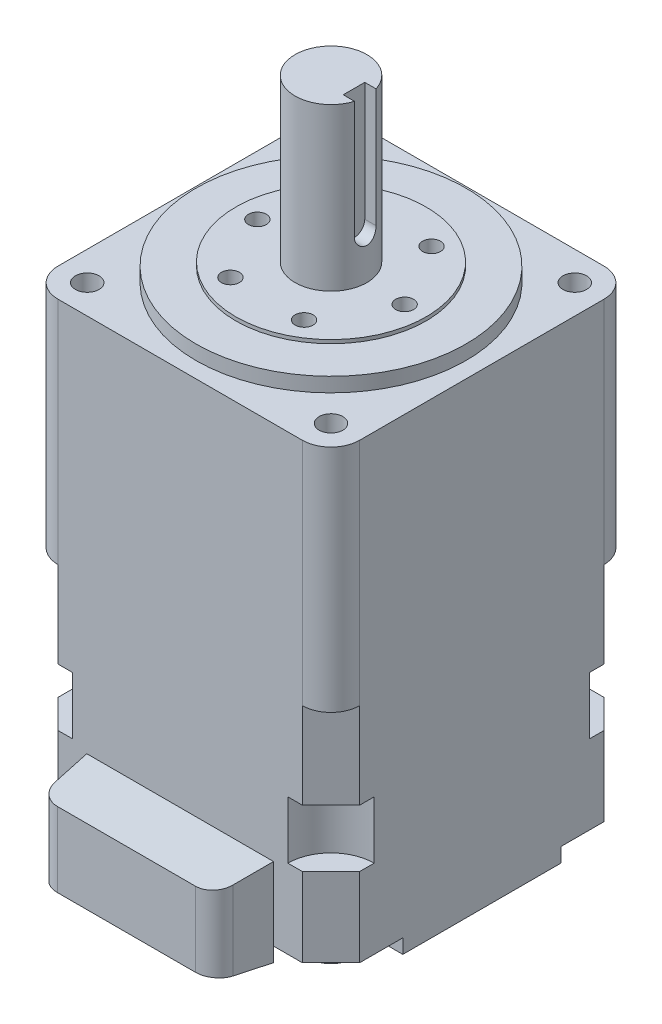
from build123d import *

# Parameters (mm, degrees)
EXTRUDE_1_DEPTH          = 65
CUT_EXTRUDE_1_DEPTH      = 33
CUT_EXTRUDE_START        = -13
CUT_EXTRUDE_2_DEPTH      = 8
CUT_EXTRUDE_3_DEPTH      = 2
SKETCH_5_R               = 3
EXTRUDE_2_DEPTH          = 1.5
SKETCH_6_W               = 26
SKETCH_6_H               = 12.2
EXTRUDE_3_DEPTH          = 7.5
CUT_EXTRUDE_4_REACH      = 80.697
CUT_EXTRUDE_5_REACH      = 76.015
FILLET_2_R               = 2.8
SKETCH_10_R              = 18.8
EXTRUDE_4_DEPTH          = 2
SKETCH_11_R              = 13.25
EXTRUDE_5_DEPTH          = 0.5
SKETCH_12_R              = 5
EXTRUDE_6_DEPTH          = 22.5
CUT_EXTRUDE_6_REACH      = 101.912
CUT_EXTRUDE_6_END_RADIUS = 5
CUT_EXTRUDE_START_2      = 3.2
HOLE_WIZARD_M3_2_D       = 2.5
HOLE_WIZARD_M3_2_DEPTH   = 6.5
HOLE_WIZARD_M3_2_TIP     = 0.751075774
HOLE_WIZARD_M4_1_D       = 3.3
HOLE_WIZARD_M4_1_DEPTH   = 10
HOLE_WIZARD_M4_1_TIP     = 0.991420021


with BuildPart() as part:
    # 草图1 → 凸台-拉伸1 (new body)
    with BuildSketch(Plane(origin=(0, 0, 0), x_dir=(1, 0, 0), z_dir=(0, 1, 0))):
        with BuildLine():
            Line((17, -21), (-17, -21))
            ThreePointArc((-17, -21), (-19.828427125, -19.828427125), (-21, -17))
            Line((-21, -17), (-21, 17))
            ThreePointArc((-21, 17), (-19.828427125, 19.828427125), (-17, 21))
            Line((-17, 21), (17, 21))
            ThreePointArc((17, 21), (19.828427125, 19.828427125), (21, 17))
            Line((21, 17), (21, -17))
            ThreePointArc((21, -17), (19.828427125, -19.828427125), (17, -21))
        make_face()
    extrude(amount=EXTRUDE_1_DEPTH)

    # 草图2 → 切除-拉伸1 (cut)
    with BuildSketch(Plane.XZ):
        with BuildLine():
            Line((-17, 21), (-21, 17))
            ThreePointArc((-21, 17), (-19.828427125, 19.828427125), (-17, 21))
        make_face()
        with BuildLine():
            Line((17, 21), (21, 17))
            ThreePointArc((21, 17), (19.828427125, 19.828427125), (17, 21))
        make_face()
        with BuildLine():
            Line((-21, -17), (-17, -21))
            ThreePointArc((-17, -21), (-19.828427125, -19.828427125), (-21, -17))
        make_face()
        with BuildLine():
            Line((21, -17), (17, -21))
            ThreePointArc((17, -21), (19.828427125, -19.828427125), (21, -17))
        make_face()
    extrude(amount=-CUT_EXTRUDE_1_DEPTH, mode=Mode.SUBTRACT)

    # 草图3 → 切除-拉伸2 (cut)
    with BuildSketch(Plane.XZ.offset(CUT_EXTRUDE_START)):
        with BuildLine():
            Line((-21, 15), (-21, 21))
            Line((-21, 21), (-15, 21))
            ThreePointArc((-15, 21), (-16.757359313, 16.757359313), (-21, 15))
        make_face()
        with BuildLine():
            Line((21, 21), (15, 21))
            ThreePointArc((15, 21), (16.757359313, 16.757359313), (21, 15))
            Line((21, 15), (21, 21))
        make_face()
        with BuildLine():
            Line((-21, -21), (-15, -21))
            ThreePointArc((-15, -21), (-16.757359313, -16.757359313), (-21, -15))
            Line((-21, -15), (-21, -21))
        make_face()
        with BuildLine():
            Line((21, -15), (21, -21))
            Line((21, -21), (15, -21))
            ThreePointArc((15, -21), (16.757359313, -16.757359313), (21, -15))
        make_face()
    extrude(amount=-CUT_EXTRUDE_2_DEPTH, mode=Mode.SUBTRACT)

    # 草图4 → 切除-拉伸3 (cut)
    with BuildSketch(Plane.XZ):
        with BuildLine():
            Line((-21, 21), (-11, 21))
            Line((-11, 21), (-11, 16))
            ThreePointArc((-11, 16), (-12.464466094, 12.464466094), (-16, 11))
            Line((-16, 11), (-21, 11))
            Line((-21, 11), (-21, 21))
        make_face()
        with BuildLine():
            Line((11, 21), (11, 16))
            ThreePointArc((11, 16), (12.464466094, 12.464466094), (16, 11))
            Line((16, 11), (21, 11))
            Line((21, 11), (21, 21))
            Line((21, 21), (11, 21))
        make_face()
        with BuildLine():
            Line((-11, -21), (-11, -16))
            ThreePointArc((-11, -16), (-12.464466094, -12.464466094), (-16, -11))
            Line((-16, -11), (-21, -11))
            Line((-21, -11), (-21, -21))
            Line((-21, -21), (-11, -21))
        make_face()
        with BuildLine():
            Line((21, -21), (11, -21))
            Line((11, -21), (11, -16))
            ThreePointArc((11, -16), (12.464466094, -12.464466094), (16, -11))
            Line((16, -11), (21, -11))
            Line((21, -11), (21, -21))
        make_face()
    extrude(amount=-CUT_EXTRUDE_3_DEPTH, mode=Mode.SUBTRACT)

    # 草图5 → 凸台-拉伸2 (add)
    with BuildSketch(Plane.XZ.offset(-2)):
        with Locations(Location((-15.5, 15.5, 0), (0, 0, 270))):
            Circle(SKETCH_5_R)
        with Locations(Location((15.5, 15.5, 0), (0, 0, 90))):
            Circle(SKETCH_5_R)
        with Locations(Location((15.5, -15.5, 0), (0, 0, 270))):
            Circle(SKETCH_5_R)
        with Locations(Location((-15.5, -15.5, 0), (0, 0, 90))):
            Circle(SKETCH_5_R)
    extrude(amount=EXTRUDE_2_DEPTH)

    # 草图6 → 凸台-拉伸3 (add)
    with BuildSketch(Plane.XY.offset(21)):
        with Locations((0, 6.1)):
            Rectangle(SKETCH_6_W, SKETCH_6_H)
    extrude(amount=EXTRUDE_3_DEPTH)

    # 草图7 → 切除-拉伸4 (cut, up to next)
    with BuildSketch(Plane.ZY.offset(13), mode=Mode.PRIVATE) as cut_extrude_4_sk1:
        Polygon((21, 12.2), (28.5, 11.292400274), (28.5, 12.2), align=None)
    cut_extrude_4_tool1 = extrude(cut_extrude_4_sk1.sketch, amount=-CUT_EXTRUDE_4_REACH, mode=Mode.PRIVATE) & part.part
    # 草图7 → 切除-拉伸4 (cut, up to next)
    with BuildSketch(Plane.ZY.offset(13), mode=Mode.PRIVATE) as cut_extrude_4_sk2:
        Polygon((28.5, 0), (28.5, 0.907599726), (21, 0), align=None)
    cut_extrude_4_tool2 = extrude(cut_extrude_4_sk2.sketch, amount=-CUT_EXTRUDE_4_REACH, mode=Mode.PRIVATE) & part.part
    add(cut_extrude_4_tool1.solids().sort_by_distance((-13, 11.897467, 26))[0], mode=Mode.SUBTRACT)
    add(cut_extrude_4_tool2.solids().sort_by_distance((-13, 0.302533, 26))[0], mode=Mode.SUBTRACT)

    # 草图9 → 切除-拉伸5 (cut, up to next)
    with BuildSketch(Plane.XZ, mode=Mode.PRIVATE) as cut_extrude_5_sk1:
        Polygon((-13, 21), (-12.092400274, 28.5), (-13, 28.5), align=None)
    cut_extrude_5_tool1 = extrude(cut_extrude_5_sk1.sketch, amount=-CUT_EXTRUDE_5_REACH, mode=Mode.PRIVATE) & part.part
    # 草图9 → 切除-拉伸5 (cut, up to next)
    with BuildSketch(Plane.XZ, mode=Mode.PRIVATE) as cut_extrude_5_sk2:
        Polygon((13, 28.5), (13, 21), (12.092400274, 28.5), align=None)
    cut_extrude_5_tool2 = extrude(cut_extrude_5_sk2.sketch, amount=-CUT_EXTRUDE_5_REACH, mode=Mode.PRIVATE) & part.part
    add(cut_extrude_5_tool1.solids().sort_by_distance((-12.697467, 0, 26))[0], mode=Mode.SUBTRACT)
    add(cut_extrude_5_tool2.solids().sort_by_distance((12.697467, 0, 26))[0], mode=Mode.SUBTRACT)

    # 圆角2
    fillet_2_edges = [part.edges().sort_by_distance(p)[0] for p in [
        (-12.092400274, 6.1, 28.5),
        (12.092400274, 6.1, 28.5),
    ]]
    fillet(fillet_2_edges, radius=FILLET_2_R)

    # 草图10 → 凸台-拉伸4 (add)
    with BuildSketch(Plane(origin=(0, 65, 0), x_dir=(1, 0, 0), z_dir=(0, 1, 0))):
        with Locations(Location((0, 0, 0), (0, 0, 270))):
            Circle(SKETCH_10_R)
    extrude(amount=EXTRUDE_4_DEPTH)

    # 草图11 → 凸台-拉伸5 (add)
    with BuildSketch(Plane(origin=(0, 67, 0), x_dir=(1, 0, 0), z_dir=(0, 1, 0))):
        with Locations(Location((0, 0, 0), (0, 0, 270))):
            Circle(SKETCH_11_R)
    extrude(amount=EXTRUDE_5_DEPTH)

    # 草图12 → 凸台-拉伸6 (add)
    with BuildSketch(Plane(origin=(0, 67.5, 0), x_dir=(1, 0, 0), z_dir=(0, 1, 0))):
        with Locations(Location((0, 0, 0), (0, 0, 90))):
            Circle(SKETCH_12_R)
    extrude(amount=EXTRUDE_6_DEPTH)

    # 切除-拉伸6: up to this cylinder (the profile starts inside it)
    cut_extrude_6_end = Plane(origin=(0, 81.75, 0), z_dir=(0, -1, 0)) * Cylinder(CUT_EXTRUDE_6_END_RADIUS, 214.824, mode=Mode.PRIVATE)
    # 草图13 → 切除-拉伸6 (cut, up to the surface)
    with BuildSketch(Plane(origin=(0, 0, 0), x_dir=(0, 0, -1), z_dir=(1, 0, 0)).offset(CUT_EXTRUDE_START_2), mode=Mode.PRIVATE) as cut_extrude_6_sk1:
        with BuildLine():
            Line((1.5, 90), (1.5, 73.5))
            ThreePointArc((1.5, 73.5), (0, 72), (-1.5, 73.5))
            Line((-1.5, 73.5), (-1.5, 90))
            ThreePointArc((-1.5, 90), (0, 91.5), (1.5, 90))
        make_face()
    cut_extrude_6_tool1 = extrude(cut_extrude_6_sk1.sketch, amount=CUT_EXTRUDE_6_REACH, mode=Mode.PRIVATE) & cut_extrude_6_end
    add(cut_extrude_6_tool1.solids().sort_by_distance((3.2, 81.75, 0))[0], mode=Mode.SUBTRACT)

    # M3 螺纹孔2
    with Locations(Plane(origin=(0, 67.5, 0), x_dir=(1, 0, 0), z_dir=(0, 1, 0))):
        with Locations((5.125, 8.876760389), (10.25, 0), (5.125, -8.876760389), (-5.125, -8.876760389), (-10.25, 0), (-5.125, 8.876760389)):
            Hole(HOLE_WIZARD_M3_2_D / 2, depth=HOLE_WIZARD_M3_2_DEPTH)
            with Locations((0, 0, -(HOLE_WIZARD_M3_2_DEPTH + HOLE_WIZARD_M3_2_TIP / 2))):  # 118° drill point
                Cone(0, HOLE_WIZARD_M3_2_D / 2, HOLE_WIZARD_M3_2_TIP, mode=Mode.SUBTRACT)

    # M4 螺纹孔1
    with Locations(Plane(origin=(0, 65, 0), x_dir=(1, 0, 0), z_dir=(0, 1, 0))):
        with Locations((-16.970562748, -16.970562748), (-16.970562748, 16.970562748), (16.970562748, -16.970562748), (16.970562748, 16.970562748)):
            Hole(HOLE_WIZARD_M4_1_D / 2, depth=HOLE_WIZARD_M4_1_DEPTH)
            with Locations((0, 0, -(HOLE_WIZARD_M4_1_DEPTH + HOLE_WIZARD_M4_1_TIP / 2))):  # 118° drill point
                Cone(0, HOLE_WIZARD_M4_1_D / 2, HOLE_WIZARD_M4_1_TIP, mode=Mode.SUBTRACT)


solid = part.part
